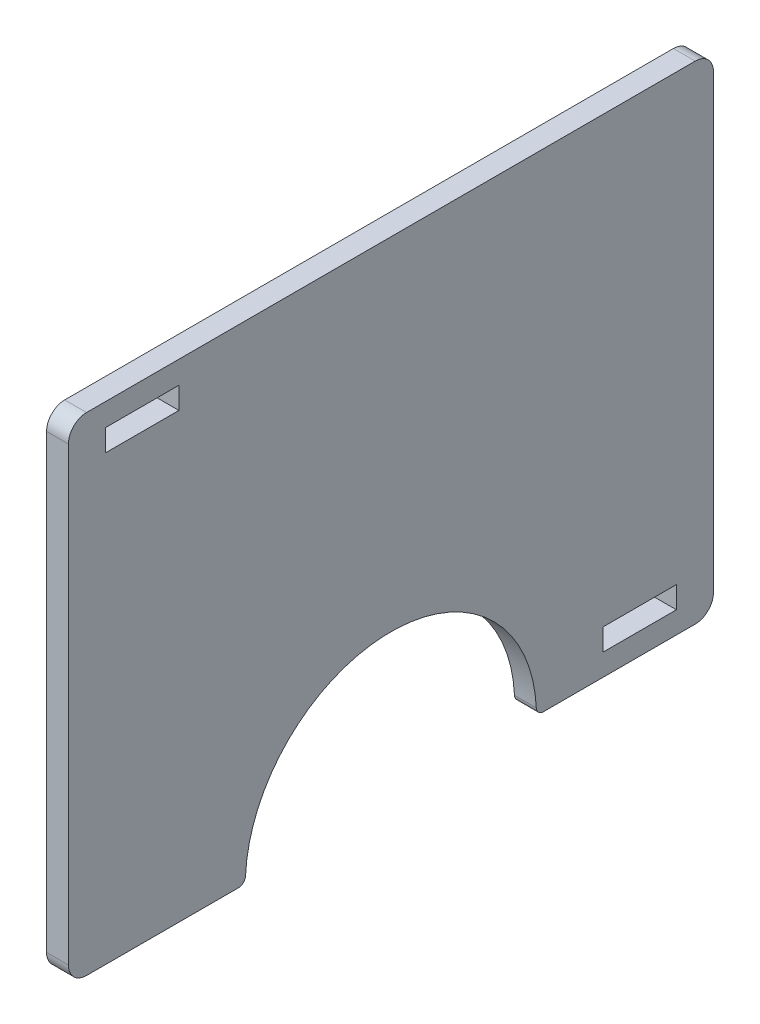
from build123d import *

# Parameters (mm, degrees)
SALIENTE_EXTRUIR1_DEPTH = 3
CROQUIS2_R              = 20
CROQUIS2_W              = 10.1
CROQUIS2_H              = 3
CORTAR_EXTRUIR1_DEPTH   = 3
REDONDEO1_R             = 1


with BuildPart() as part:
    # Croquis1 → Saliente-Extruir1 (new body)
    with BuildSketch(Plane(origin=(0, 0, 0), x_dir=(0, 0, -1), z_dir=(1, 0, 0))):
        with BuildLine():
            Line((-41.82, 33.5), (41.82, 33.5))
            ThreePointArc((41.82, 33.5), (43.587766953, 32.767766953), (44.32, 31))
            Line((44.32, 31), (44.32, -31))
            ThreePointArc((44.32, -31), (43.587766953, -32.767766953), (41.82, -33.5))
            Line((41.82, -33.5), (-41.82, -33.5))
            ThreePointArc((-41.82, -33.5), (-43.587766953, -32.767766953), (-44.32, -31))
            Line((-44.32, -31), (-44.32, 31))
            ThreePointArc((-44.32, 31), (-43.587766953, 32.767766953), (-41.82, 33.5))
        make_face()
    extrude(amount=SALIENTE_EXTRUIR1_DEPTH)

    # Croquis2 → Cortar-Extruir1 (cut, symmetric)
    with BuildSketch(Plane(origin=(3, 0, 0), x_dir=(0, 0, -1), z_dir=(1, 0, 0))):
        with Locations((0, -33.5)):
            Circle(CROQUIS2_R)
        with Locations((34.18, -29)):
            Rectangle(CROQUIS2_W, CROQUIS2_H)
        with Locations((-34.18, 28.9)):
            Rectangle(CROQUIS2_W, CROQUIS2_H)
    extrude(amount=CORTAR_EXTRUIR1_DEPTH, both=True, mode=Mode.SUBTRACT)

    # Redondeo1
    redondeo1_edges = [part.edges().sort_by_distance(p)[0] for p in [
        (1.5, -33.5, 20),
        (1.5, -33.5, -20),
    ]]
    fillet(redondeo1_edges, radius=REDONDEO1_R)


solid = part.part
